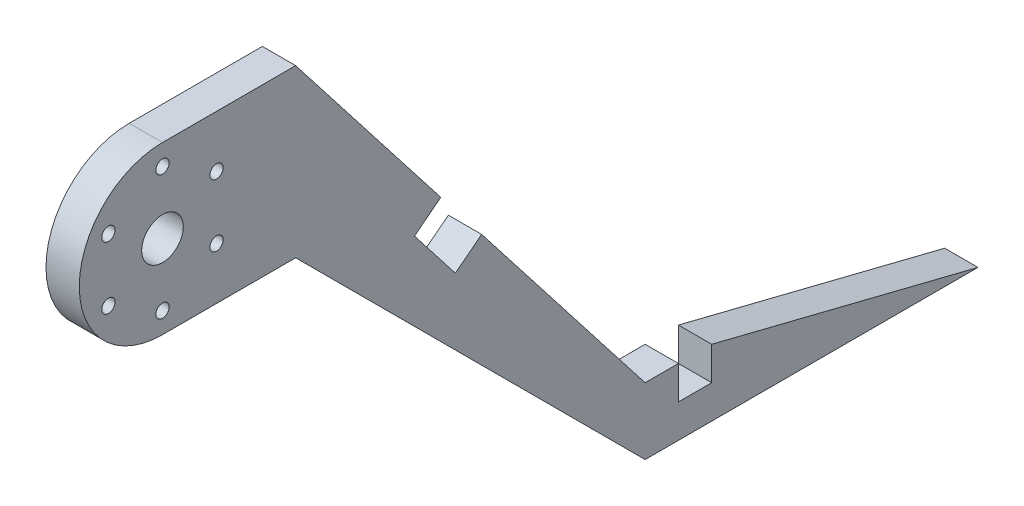
from build123d import *

# Parameters (mm, degrees)
MAIN_DEPTH    = 12.7
SKETCH2_R     = 7.9375
AXLE_DEPTH    = 12.7
SKETCH5_W     = 12.7
SKETCH5_H     = 25.4
BARWIDE_DEPTH = 12.7
SKETCH6_R     = 2.54
SCREWS_DEPTH  = 12.7


with BuildPart() as part:
    # Sketch1 → main (new body)
    with BuildSketch(Plane(origin=(0, 0, 0), x_dir=(0, 0, -1), z_dir=(1, 0, 0))):
        with BuildLine():
            Line((0, 31.75), (50.8, 31.75))
            Line((50.8, 31.75), (184.15, -139.7))
            Line((184.15, -139.7), (196.85, -139.7))
            Line((196.85, -139.7), (196.85, -152.4))
            Line((196.85, -152.4), (209.55, -152.4))
            Line((209.55, -152.4), (209.55, -139.7))
            Line((209.55, -139.7), (311.15, -165.1))
            Line((311.15, -165.1), (184.15, -165.1))
            Line((184.15, -165.1), (50.8, -31.75))
            Line((50.8, -31.75), (0, -31.75))
            ThreePointArc((0, -31.75), (-31.75, 0), (0, 31.75))
        make_face()
    extrude(amount=MAIN_DEPTH)

    # Sketch2 → axle (cut)
    with BuildSketch(Plane(origin=(12.7, 0, 0), x_dir=(0, 0, -1), z_dir=(1, 0, 0))):
        Circle(SKETCH2_R)
    extrude(amount=-AXLE_DEPTH, mode=Mode.SUBTRACT)

    # Sketch5 → barwide (cut)
    with BuildSketch(Plane(origin=(0, 36.585769231, -47.038846154), x_dir=(-1, 0, 0), z_dir=(0, 0.6139406135149222, -0.789352217376325))):
        with Locations((-6.35, -109.029668746)):
            Rectangle(SKETCH5_W, SKETCH5_H)
    extrude(amount=-BARWIDE_DEPTH, mode=Mode.SUBTRACT)

    # Sketch6 → screws (cut)
    with BuildSketch(Plane.ZY):
        with Locations((0, 23.8125)):
            Circle(SKETCH6_R)
        with Locations((20.622229928, 11.90625)):
            Circle(SKETCH6_R)
        with Locations((20.622229928, -11.90625)):
            Circle(SKETCH6_R)
        with Locations((0, -23.8125)):
            Circle(SKETCH6_R)
        with Locations((-20.622229928, -11.90625)):
            Circle(SKETCH6_R)
        with Locations((-20.622229928, 11.90625)):
            Circle(SKETCH6_R)
    extrude(amount=-SCREWS_DEPTH, mode=Mode.SUBTRACT)


solid = part.part
